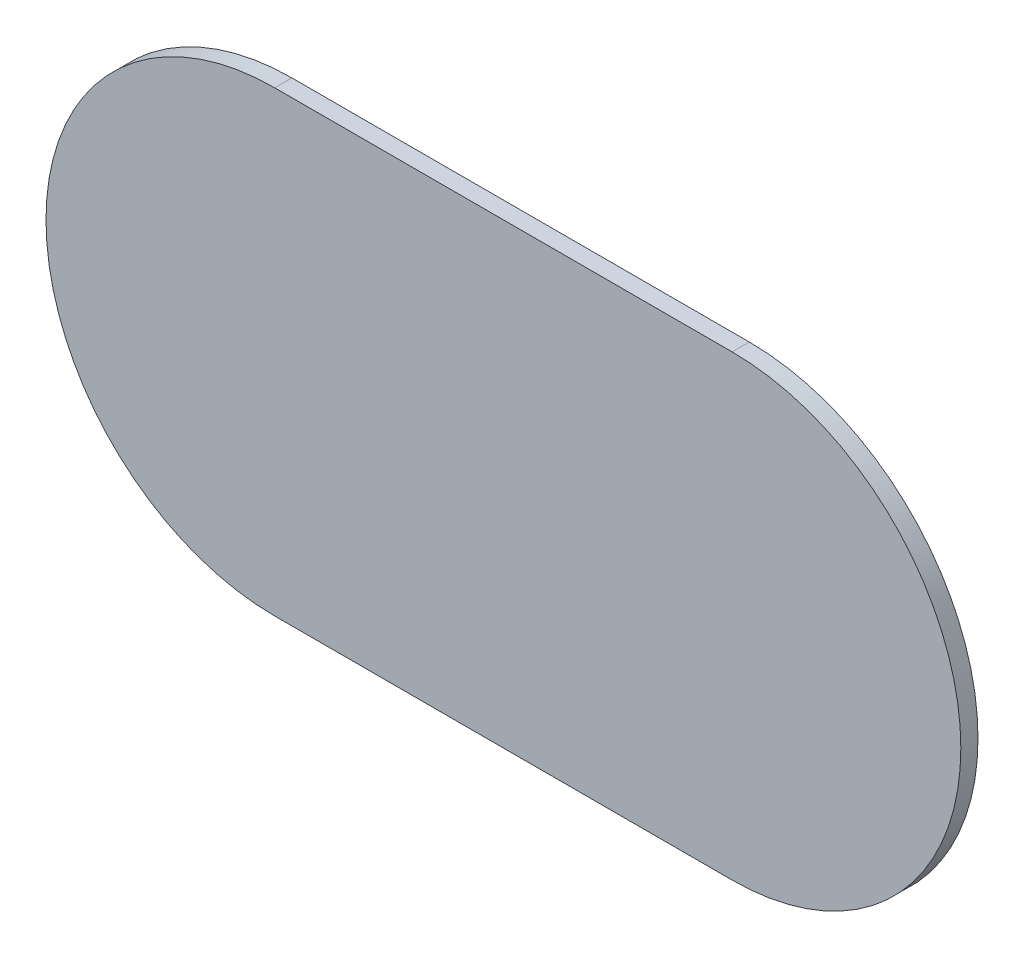
from build123d import *

# Parameters (mm, degrees)
EXTRUDE_1_DEPTH = 3


with BuildPart() as part:
    # Эскиз1 → Бобышка-Вытянуть1 (new body)
    with BuildSketch(Plane.XY):
        with BuildLine():
            Line((-40, 40), (40, 40))
            ThreePointArc((40, 40), (80, 0), (40, -40))
            Line((40, -40), (-40, -40))
            ThreePointArc((-40, -40), (-80, 0), (-40, 40))
        make_face()
    extrude(amount=EXTRUDE_1_DEPTH)


solid = part.part
